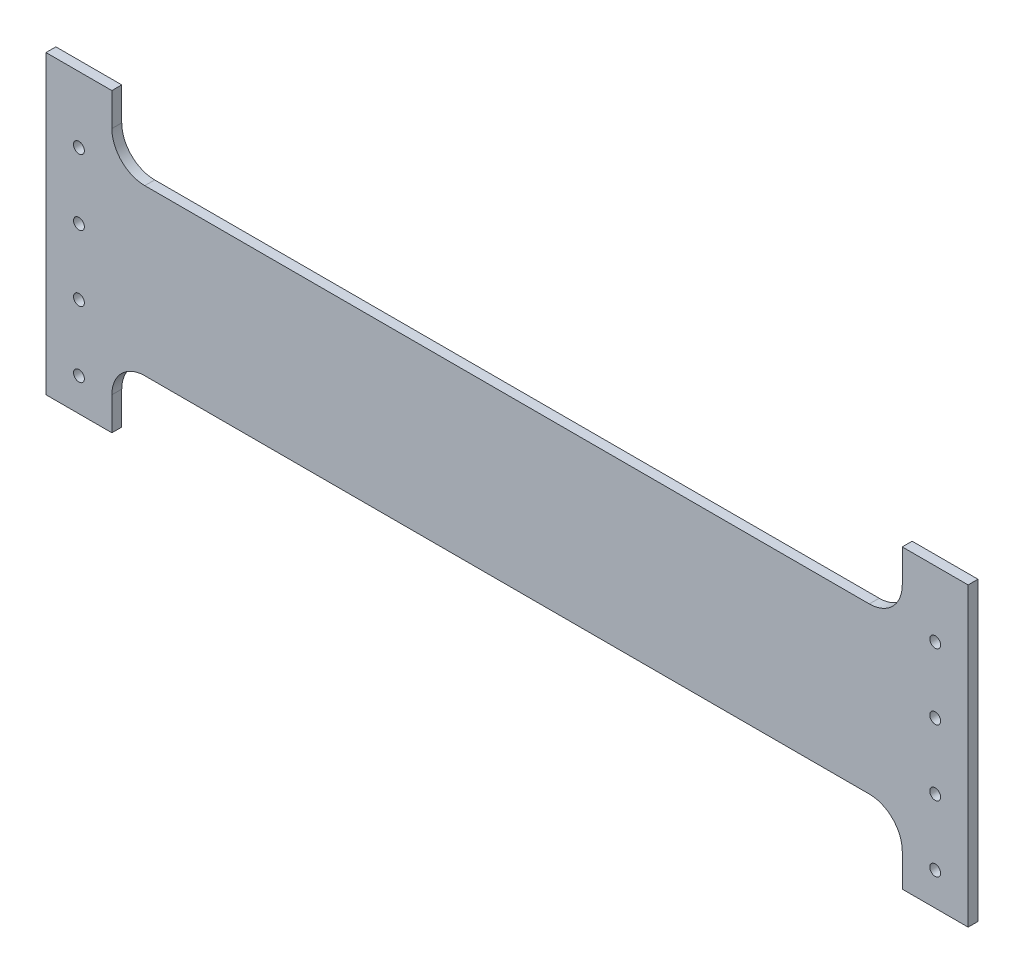
from build123d import *

# Parameters (mm, degrees)
SKETCH_1_R      = 1.65
EXTRUDE_1_DEPTH = 3


with BuildPart() as part:
    # 草图1 → 凸台-拉伸1 (new body)
    with BuildSketch(Plane.XY):
        with BuildLine():
            Line((-110, 25), (110, 25))
            ThreePointArc((110, 25), (117.071067812, 27.928932188), (120, 35))
            Line((120, 35), (120, 45))
            Line((120, 45), (140, 45))
            Line((140, 45), (140, -45))
            Line((140, -45), (120, -45))
            Line((120, -45), (120, -35))
            ThreePointArc((120, -35), (117.071067812, -27.928932188), (110, -25))
            Line((110, -25), (-110, -25))
            ThreePointArc((-110, -25), (-117.071067812, -27.928932188), (-120, -35))
            Line((-120, -35), (-120, -45))
            Line((-120, -45), (-140, -45))
            Line((-140, -45), (-140, 45))
            Line((-140, 45), (-120, 45))
            Line((-120, 45), (-120, 35))
            ThreePointArc((-120, 35), (-117.071067812, 27.928932188), (-110, 25))
        make_face()
        with Locations((-130, 25)):
            Circle(SKETCH_1_R, mode=Mode.SUBTRACT)
        with Locations((-130, 5)):
            Circle(SKETCH_1_R, mode=Mode.SUBTRACT)
        with Locations((-130, -15)):
            Circle(SKETCH_1_R, mode=Mode.SUBTRACT)
        with Locations((-130, -35)):
            Circle(SKETCH_1_R, mode=Mode.SUBTRACT)
        with Locations(Location((130, -35, 0), (0, 0, 180))):
            Circle(SKETCH_1_R, mode=Mode.SUBTRACT)
        with Locations(Location((130, -15, 0), (0, 0, 180))):
            Circle(SKETCH_1_R, mode=Mode.SUBTRACT)
        with Locations(Location((130, 5, 0), (0, 0, 180))):
            Circle(SKETCH_1_R, mode=Mode.SUBTRACT)
        with Locations(Location((130, 25, 0), (0, 0, 180))):
            Circle(SKETCH_1_R, mode=Mode.SUBTRACT)
    extrude(amount=EXTRUDE_1_DEPTH)


solid = part.part
